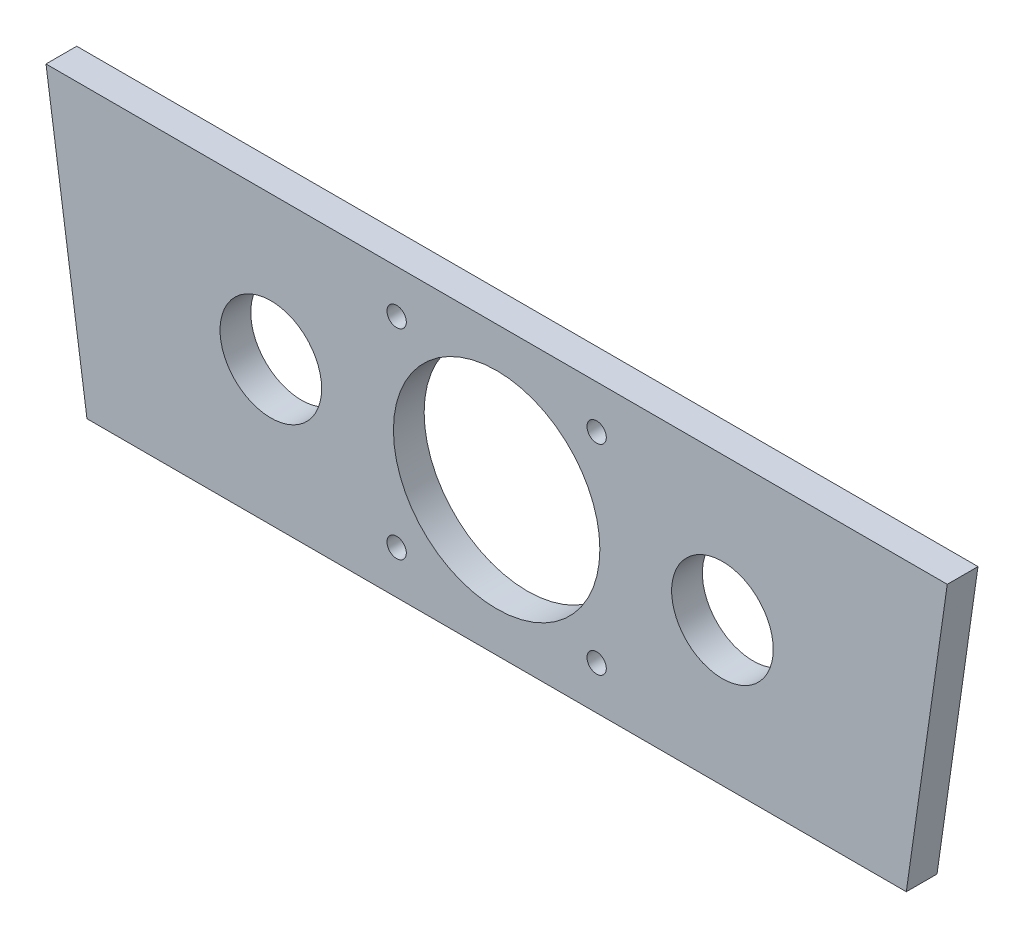
from build123d import *

# Parameters (mm, degrees)
BOSS_EXTRUDE1_DEPTH = 4.7625
SKETCH2_3_R         = 1.5
SKETCH2_3_R_2       = 7.874
SKETCH2_3_R_3       = 16
BOSS_EXTRUDE2_DEPTH = 4.7625
CUT_EXTRUDE1_DEPTH  = 4.7625


with BuildPart() as part:
    # Sketch2 → Boss-Extrude1 (new body)
    with BuildSketch(Plane.XY):
        Polygon((139.7, 6.35), (146.05, 50.8), (152.4, 50.8), (152.4, 0), (0, 0), (0, 50.8), (6.35, 50.8), (12.7, 6.35), align=None)
    extrude(amount=BOSS_EXTRUDE1_DEPTH)

    # Sketch2<3> → Boss-Extrude2 (add)
    # profile 1 of 2: a face of its own
    with BuildSketch(Plane.XY):
        Polygon((0, 50.8), (0, 0), (152.4, 0), (152.4, 50.8), (146.05, 50.8), (139.7, 6.35), (12.7, 6.35), (6.35, 50.8), align=None)
    # profile 2 of 2: a face of its own
    with BuildSketch(Plane.XY):
        Polygon((146.05, 50.8), (6.35, 50.8), (12.7, 6.35), (139.7, 6.35), align=None)
        with Locations((60.7, 13.075)):
            Circle(SKETCH2_3_R, mode=Mode.SUBTRACT)
        with Locations((91.7, 13.075)):
            Circle(SKETCH2_3_R, mode=Mode.SUBTRACT)
        with Locations((41.2, 28.575)):
            Circle(SKETCH2_3_R_2, mode=Mode.SUBTRACT)
        with Locations((60.7, 44.075)):
            Circle(SKETCH2_3_R, mode=Mode.SUBTRACT)
        with Locations((76.2, 28.575)):
            Circle(SKETCH2_3_R_3, mode=Mode.SUBTRACT)
        with Locations((111.2, 28.575)):
            Circle(SKETCH2_3_R_2, mode=Mode.SUBTRACT)
        with Locations((91.7, 44.075)):
            Circle(SKETCH2_3_R, mode=Mode.SUBTRACT)
    extrude(amount=BOSS_EXTRUDE2_DEPTH)

    # Sketch2<4> → Cut-Extrude1 (cut)
    with BuildSketch(Plane.XY):
        Polygon((139.7, 6.35), (146.05, 50.8), (152.4, 50.8), (152.4, 0), (0, 0), (0, 50.8), (6.35, 50.8), (12.7, 6.35), align=None)
    extrude(amount=CUT_EXTRUDE1_DEPTH, mode=Mode.SUBTRACT)


solid = part.part
